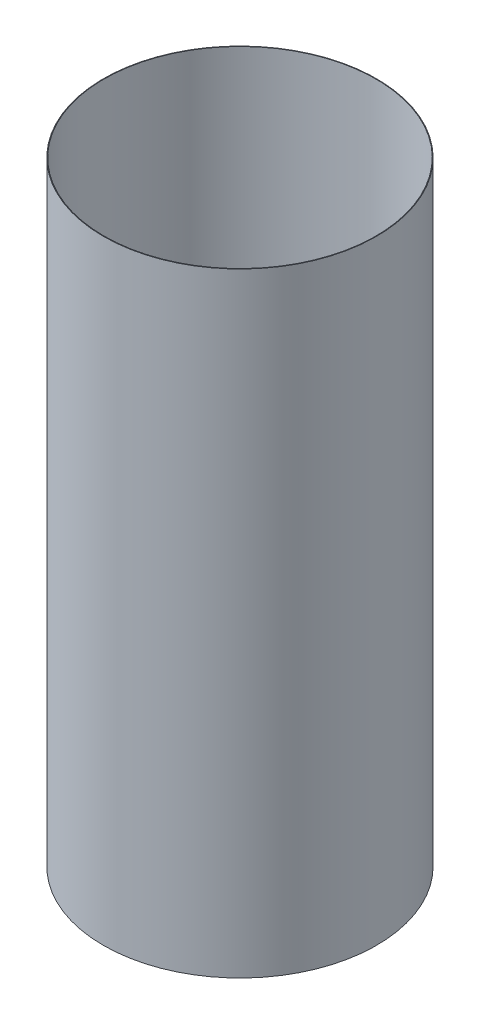
from build123d import *

# Parameters (mm, degrees)
SKETCH1_R           = 28.956
SKETCH1_R_2         = 28.829
BOSS_EXTRUDE1_DEPTH = 130.175


with BuildPart() as part:
    # Sketch1 → Boss-Extrude1 (new body)
    with BuildSketch(Plane(origin=(0, 0, 0), x_dir=(1, 0, 0), z_dir=(0, 1, 0))):
        with Locations(Location((0, 0, 0), (0, 0, 270))):
            Circle(SKETCH1_R)
        with Locations(Location((0, 0, 0), (0, 0, 270))):
            Circle(SKETCH1_R_2, mode=Mode.SUBTRACT)
    extrude(amount=BOSS_EXTRUDE1_DEPTH)


solid = part.part
